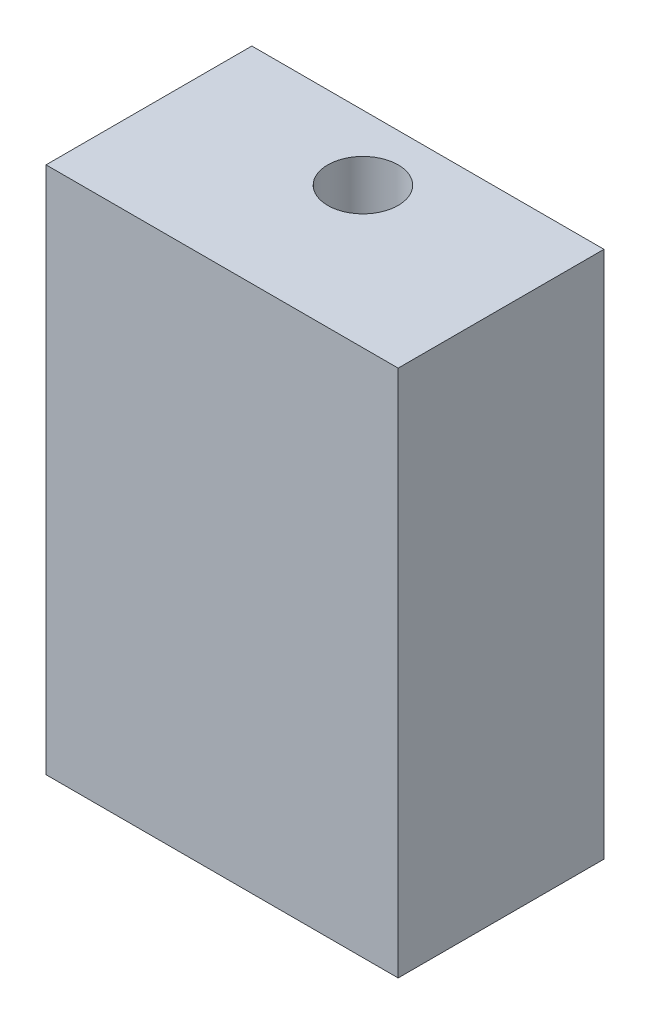
from build123d import *

# Parameters (mm, degrees)
SKETCH_1_W      = 20
SKETCH_1_H      = 11.69
SKETCH_1_R      = 2
EXTRUDE_1_DEPTH = 30


with BuildPart() as part:
    # Эскиз1 → Бобышка-Вытянуть1 (new body)
    with BuildSketch(Plane(origin=(0, 0, 0), x_dir=(1, 0, 0), z_dir=(0, 1, 0))):
        with Locations((0, -2.155)):
            Rectangle(SKETCH_1_W, SKETCH_1_H)
        with Locations(Location((0, 0, 0), (0, 0, 270))):
            Circle(SKETCH_1_R, mode=Mode.SUBTRACT)
    extrude(amount=EXTRUDE_1_DEPTH)


solid = part.part
